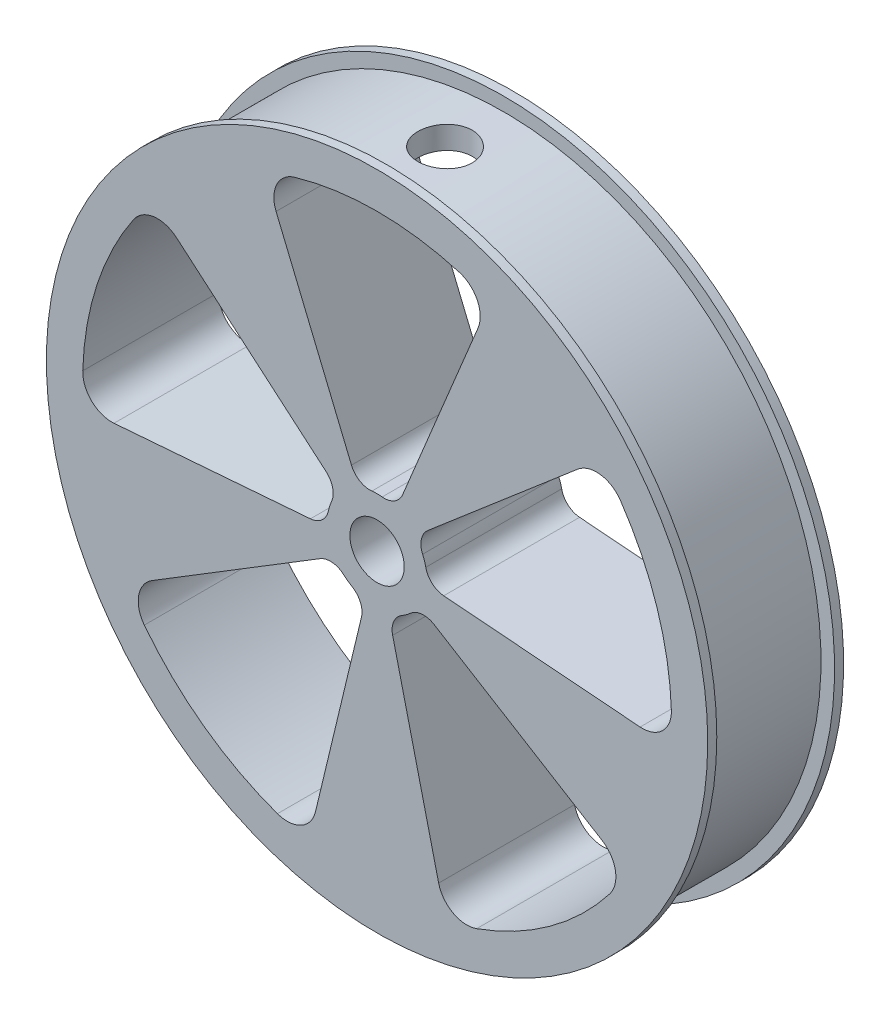
from build123d import *

# Parameters (mm, degrees)
SKETCH1_R               = 35
BOSS_EXTRUDE1_DEPTH     = 15
SKETCH2_R               = 3
CUT_EXTRUDE1_DEPTH      = 52.720402164
CUT_EXTRUDE3_DEPTH      = 52.720402164
CIRPATTERN1_COUNT       = 5
FILLET4_R               = 2.2
FILLET5_R               = 3.2
SKETCH5_R               = 36.5
SKETCH5_R_2             = 35
BOSS_EXTRUDE2_DEPTH     = 1
BOSS_EXTRUDE3_START     = -1
SKETCH6_R               = 36.5
SKETCH6_R_2             = 35
BOSS_EXTRUDE3_DEPTH     = 1
SKETCH7_R               = 1.55
CUT_EXTRUDE4_DEPTH      = 54.754069613
CUT_EXTRUDE5_DEPTH      = 54.754069641
CUT_EXTRUDE5_DEPTH_BACK = 1
CUT_EXTRUDE5_START      = 20
SKETCH8_R               = 3


with BuildPart() as part:
    # Sketch1 → Boss-Extrude1 (new body)
    with BuildSketch(Plane.XY):
        Circle(SKETCH1_R)
    extrude(amount=BOSS_EXTRUDE1_DEPTH)

    # Sketch2 → Cut-Extrude1 (cut, through all)
    with BuildSketch(Plane(origin=(0, 0, 0), x_dir=(-1, 0, 0), z_dir=(0, 0, -1))):
        Circle(SKETCH2_R)
    extrude(amount=-CUT_EXTRUDE1_DEPTH, mode=Mode.SUBTRACT)

    # Sketch4 → Cut-Extrude3 (cut, through all)
    with BuildSketch(Plane(origin=(0, 0, 0), x_dir=(-1, 0, 0), z_dir=(0, 0, -1))):
        with BuildLine():
            Line((2.104758878, 5.081337429), (12.437211552, 30.026084807))
            ThreePointArc((12.437211552, 30.026084807), (0, 32.5), (-12.437211552, 30.026084807))
            Line((-12.437211552, 30.026084807), (-2.104758878, 5.081337429))
            ThreePointArc((-2.104758878, 5.081337429), (0, 5.5), (2.104758878, 5.081337429))
        make_face()
    cut_extrude3 = extrude(amount=-CUT_EXTRUDE3_DEPTH, mode=Mode.SUBTRACT)

    # CirPattern1: Cut-Extrude3 ×5 about axis
    cirpattern1_axis = Axis((0, 0, 0), (0, 0, 1))
    for i in range(1, CIRPATTERN1_COUNT):
        add(cut_extrude3.rotate(cirpattern1_axis, i * 360 / CIRPATTERN1_COUNT), mode=Mode.SUBTRACT)

    # Fillet4
    fillet4_edges = [part.edges().sort_by_distance(p)[0] for p in [
        (-2.104758878, 5.081337429, 7.5),
        (2.104758878, 5.081337429, 7.5),
        (-5.483045336, -0.431525027, 7.5),
        (-4.182232811, 3.571964266, 7.5),
        (-1.283949501, -5.348034562, 7.5),
        (-4.689520904, -2.873742106, 7.5),
        (4.689520904, -2.873742106, 7.5),
        (1.283949501, -5.348034562, 7.5),
        (4.182232811, 3.571964266, 7.5),
        (5.483045336, -0.431525027, 7.5),
    ]]
    fillet(fillet4_edges, radius=FILLET4_R)

    # Fillet5
    fillet5_edges = [part.edges().sort_by_distance(p)[0] for p in [
        (12.437211552, 30.026084807, 7.5),
        (-12.437211552, 30.026084807, 7.5),
        (-24.713193882, 21.107061571, 7.5),
        (-32.399813346, -2.549920611, 7.5),
        (-27.710805342, -16.981203353, 7.5),
        (-7.586974325, -31.602022413, 7.5),
        (7.586974325, -31.602022413, 7.5),
        (27.710805342, -16.981203353, 7.5),
        (32.399813346, -2.549920611, 7.5),
        (24.713193882, 21.107061571, 7.5),
    ]]
    fillet(fillet5_edges, radius=FILLET5_R)

    # Sketch5 → Boss-Extrude2 (add)
    with BuildSketch(Plane(origin=(0, 0, 0), x_dir=(-1, 0, 0), z_dir=(0, 0, -1))):
        Circle(SKETCH5_R)
        Circle(SKETCH5_R_2, mode=Mode.SUBTRACT)
    extrude(amount=-BOSS_EXTRUDE2_DEPTH)

    # Sketch6 → Boss-Extrude3 (add)
    with BuildSketch(Plane.XY.offset(15).offset(BOSS_EXTRUDE3_START)):
        with Locations(Location((0, 0, 0), (0, 0, 180))):
            Circle(SKETCH6_R)
        with Locations(Location((0, 0, 0), (0, 0, 180))):
            Circle(SKETCH6_R_2, mode=Mode.SUBTRACT)
    extrude(amount=BOSS_EXTRUDE3_DEPTH)

    # Sketch7 → Cut-Extrude4 (cut, through all)
    with BuildSketch(Plane(origin=(0, 0, 0), x_dir=(1, 0, 0), z_dir=(0, 1, 0))):
        with Locations(Location((0, -7.5, 0), (0, 0, 90))):
            Circle(SKETCH7_R)
    extrude(amount=CUT_EXTRUDE4_DEPTH, mode=Mode.SUBTRACT)

    # Sketch8 → Cut-Extrude5 (cut, two sides: drawn at the far end of the back side and taken through both)
    with BuildSketch(Plane(origin=(0, 0, 0), x_dir=(1, 0, 0), z_dir=(0, 1, 0)).offset(CUT_EXTRUDE5_START - CUT_EXTRUDE5_DEPTH_BACK)):
        with Locations(Location((0, -7.5, 0), (0, 0, 90))):
            Circle(SKETCH8_R)
    extrude(amount=CUT_EXTRUDE5_DEPTH + CUT_EXTRUDE5_DEPTH_BACK, mode=Mode.SUBTRACT)


solid = part.part
